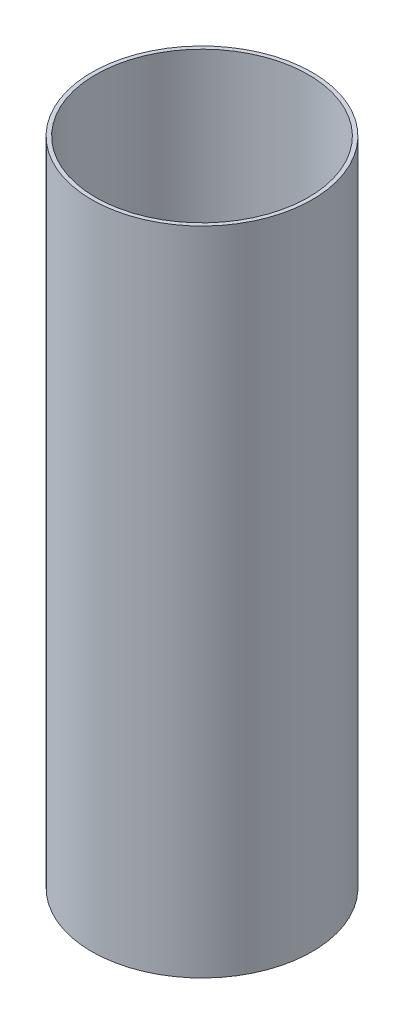
from build123d import *

# Parameters (mm, degrees)
SKETCH1_R           = 50.8
SKETCH1_R_2         = 49
BOSS_EXTRUDE1_DEPTH = 300


with BuildPart() as part:
    # Sketch1 → Boss-Extrude1 (new body)
    with BuildSketch(Plane(origin=(0, 0, 0), x_dir=(1, 0, 0), z_dir=(0, 1, 0))):
        with Locations(Location((0, 0, 0), (0, 0, 270))):
            Circle(SKETCH1_R)
        with Locations(Location((0, 0, 0), (0, 0, 270))):
            Circle(SKETCH1_R_2, mode=Mode.SUBTRACT)
    extrude(amount=BOSS_EXTRUDE1_DEPTH)


solid = part.part
